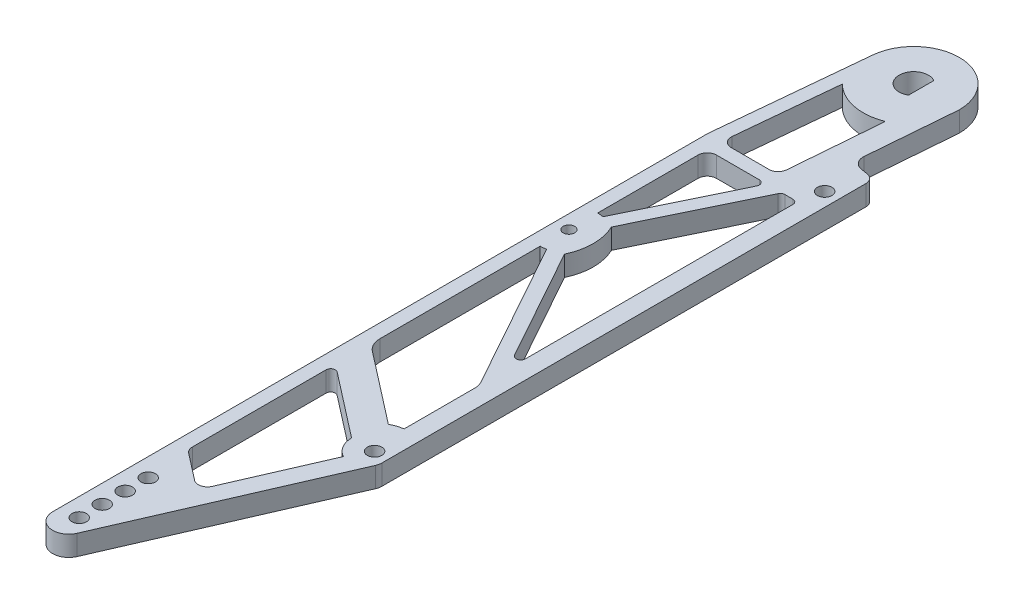
from build123d import *

# Parameters (mm, degrees)
SKETCH2_R           = 2
SKETCH2_R_2         = 1.5875
SKETCH2_R_3         = 1.999999991
BOSS_EXTRUDE1_DEPTH = 5.588


with BuildPart() as part:
    # Sketch2 → Boss-Extrude1 (new body)
    with BuildSketch(Plane(origin=(0, 0, 0), x_dir=(1, 0, 0), z_dir=(0, 1, 0))):
        with BuildLine():
            ThreePointArc((17.295902343, -30.526810701), (16.688093876, -28.878103365), (15.15555913, -28.018449791))
            Line((15.15555913, -28.018449791), (13.238676936, -27.713033224))
            ThreePointArc((13.238676936, -27.713033224), (11.241051513, -26.538356195), (10.573787778, -24.319092227))
            Line((10.573787778, -24.319092227), (12.5603, 0))
            ThreePointArc((12.5603, 0), (0.603657177, 12.545785512), (-12.502275592, 1.2059192))
            Line((-12.502275592, 1.2059192), (-16.498266045, -40.222207921))
            ThreePointArc((-16.498266045, -40.222207921), (-16.507064815, -40.344000039), (-16.51, -40.466074291))
            Line((-16.51, -40.466074291), (-16.51, -221.328861788))
            ThreePointArc((-16.51, -221.328861788), (-12.970187584, -225.680718913), (-7.988667969, -223.101301399))
            Line((-7.988667969, -223.101301399), (16.979901226, -165.677523619))
            ThreePointArc((16.979901226, -165.677523619), (17.216065593, -164.934164738), (17.295902343, -164.158289667))
            Line((17.295902343, -164.158289667), (17.295902343, -30.526810701))
        make_face()
        with Locations(Location((-11.43, -219.075, 0), (0, 0, 270))):
            Circle(SKETCH2_R, mode=Mode.SUBTRACT)
        with Locations(Location((-11.43, -212.725, 0), (0, 0, 270))):
            Circle(SKETCH2_R, mode=Mode.SUBTRACT)
        with Locations(Location((-11.43, -206.375, 0), (0, 0, 270))):
            Circle(SKETCH2_R, mode=Mode.SUBTRACT)
        with Locations(Location((-11.43, -200.025, 0), (0, 0, 270))):
            Circle(SKETCH2_R, mode=Mode.SUBTRACT)
        with BuildLine():
            ThreePointArc((7.135902343, -162.410770806), (8.023611961, -165.648962244), (10.438542905, -167.981776143))
            Line((10.438542905, -167.981776143), (-0.534170778, -193.217289931))
            ThreePointArc((-0.534170778, -193.217289931), (-2.234040931, -194.665234867), (-4.420389569, -194.211381682))
            Line((-4.420389569, -194.211381682), (-11.716886202, -188.551043102))
            ThreePointArc((-11.716886202, -188.551043102), (-12.441018517, -187.661516081), (-12.7, -186.544128716))
            Line((-12.7, -186.544128716), (-12.7, -149.615408258))
            ThreePointArc((-12.7, -149.615408258), (-11.988693683, -148.474898999), (-10.651556899, -148.611951065))
            Line((-10.651556899, -148.611951065), (7.135902343, -162.410770806))
        make_face(mode=Mode.SUBTRACT)
        with BuildLine():
            ThreePointArc((12.215902343, -152.970817152), (10.520298026, -153.359206519), (8.923603828, -154.049487576))
            Line((8.923603828, -154.049487576), (-10.733772403, -138.80005889))
            ThreePointArc((-10.733772403, -138.80005889), (-12.182037035, -137.021004847), (-12.7, -134.786230117))
            Line((-12.7, -134.786230117), (-12.7, -90.4875))
            ThreePointArc((-12.7, -90.4875), (-11.888769677, -90.445936399), (-11.086035141, -90.321680879))
            Line((-11.086035141, -90.321680879), (11.575760855, -131.079432803))
            ThreePointArc((11.575760855, -131.079432803), (12.053263487, -132.272915946), (12.215902343, -133.548047069))
            Line((12.215902343, -133.548047069), (12.215902343, -152.970817152))
        make_face(mode=Mode.SUBTRACT)
        with Locations(Location((13.485902343, -162.410770806, 0), (0, 0, 270))):
            Circle(SKETCH2_R, mode=Mode.SUBTRACT)
        with Locations(Location((-12.7, -82.55, 0), (0, 0, 270))):
            Circle(SKETCH2_R_2, mode=Mode.SUBTRACT)
        with BuildLine():
            Line((-10.16, -44.337182032), (1.663048834, -44.337182032))
            ThreePointArc((1.663048834, -44.337182032), (2.739129831, -44.932682449), (2.806066447, -46.160725831))
            Line((2.806066447, -46.160725831), (-11.055993219, -74.784618621))
            ThreePointArc((-11.055993219, -74.784618621), (-11.873503915, -74.655646925), (-12.7, -74.6125))
            Line((-12.7, -74.6125), (-12.7, -46.877182032))
            ThreePointArc((-12.7, -46.877182032), (-11.956051224, -45.081130808), (-10.16, -44.337182032))
        make_face(mode=Mode.SUBTRACT)
        with BuildLine():
            ThreePointArc((-9.903213406, -40.527182032), (-11.783508673, -39.694838236), (-12.431479451, -37.743315662))
            Line((-12.431479451, -37.743315662), (-9.755434212, -9.99962016))
            ThreePointArc((-9.755434212, -9.99962016), (-2.756273581, -13.695395429), (5.127655889, -12.99492382))
            Line((5.127655889, -12.99492382), (3.069264048, -38.19397392))
            ThreePointArc((3.069264048, -38.19397392), (2.259083254, -39.854914801), (0.537695935, -40.527182032))
            Line((0.537695935, -40.527182032), (-9.903213406, -40.527182032))
        make_face(mode=Mode.SUBTRACT)
        with BuildLine():
            ThreePointArc((2.05, -3.492849839), (-4.05, 0), (2.05, 3.492849839))
            Line((2.05, 3.492849839), (2.05, -3.492849839))
        make_face(mode=Mode.SUBTRACT)
        with BuildLine():
            ThreePointArc((-7.44734835, -89.025591197), (-5.976040897, -82.55), (-7.44734835, -76.074408803))
            Line((-7.44734835, -76.074408803), (7.575478058, -45.053638233))
            ThreePointArc((7.575478058, -45.053638233), (8.043996088, -44.531101035), (8.718495671, -44.337182032))
            Line((8.718495671, -44.337182032), (10.945902343, -44.337182032))
            ThreePointArc((10.945902343, -44.337182032), (11.843927955, -44.70915642), (12.215902343, -45.607182032))
            Line((12.215902343, -45.607182032), (12.215902343, -119.492817968))
            ThreePointArc((12.215902343, -119.492817968), (11.264685124, -120.722158254), (9.835937715, -120.109971535))
            Line((9.835937715, -120.109971535), (-7.44734835, -89.025591197))
        make_face(mode=Mode.SUBTRACT)
        with Locations(Location((13.485902343, -38.1, 0), (0, 0, 270))):
            Circle(SKETCH2_R_3, mode=Mode.SUBTRACT)
    extrude(amount=BOSS_EXTRUDE1_DEPTH)


solid = part.part
